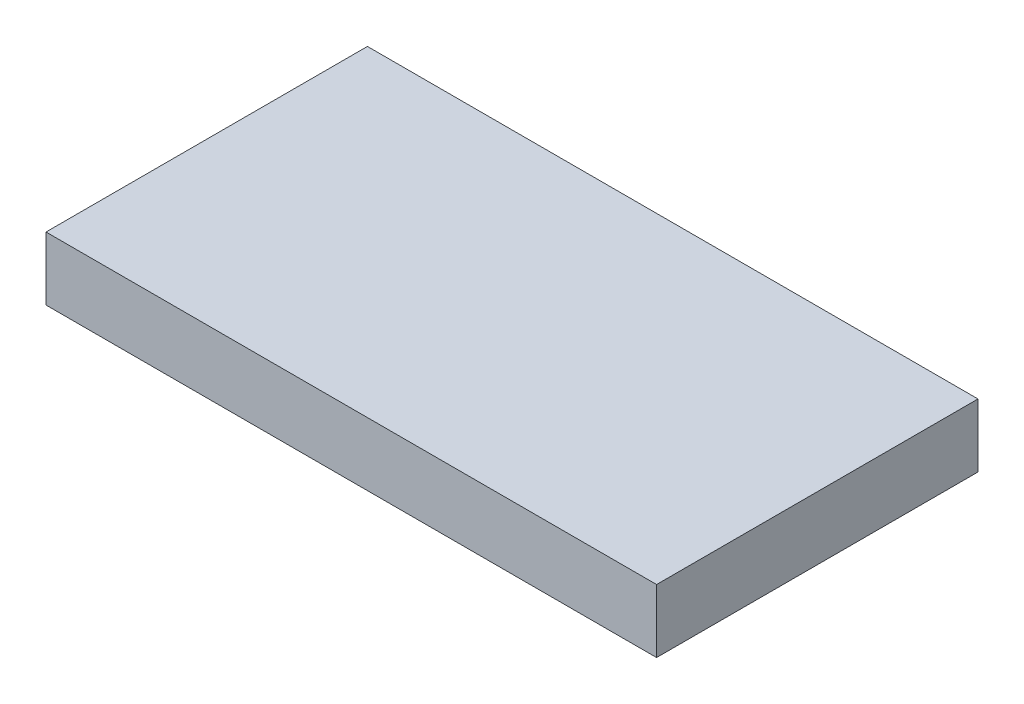
from build123d import *

# Parameters (mm, degrees)
SKETCH1_W           = 965
SKETCH1_H           = 508
BOSS_EXTRUDE1_DEPTH = 100
SKETCH5_R           = 20
CUT_EXTRUDE1_DEPTH  = 50


with BuildPart() as part:
    # Sketch1 → Boss-Extrude1 (new body)
    with BuildSketch(Plane(origin=(0, 0, 0), x_dir=(1, 0, 0), z_dir=(0, 1, 0))):
        Rectangle(SKETCH1_W, SKETCH1_H)
    extrude(amount=BOSS_EXTRUDE1_DEPTH)

    # Sketch5 → Cut-Extrude1 (cut)
    with BuildSketch(Plane.XZ):
        with Locations(Location((254, 204, 0), (0, 0, 270))):
            Circle(SKETCH5_R)
        with Locations(Location((254, -204, 0), (0, 0, 270))):
            Circle(SKETCH5_R)
    cut_extrude1 = extrude(amount=-CUT_EXTRUDE1_DEPTH, mode=Mode.SUBTRACT)

    # Mirror1: Cut-Extrude1 across plane
    add(cut_extrude1.mirror(Plane(origin=(0, 0, 0), x_dir=(0, 0, 1), z_dir=(1, 0, 0))), mode=Mode.SUBTRACT)


solid = part.part
